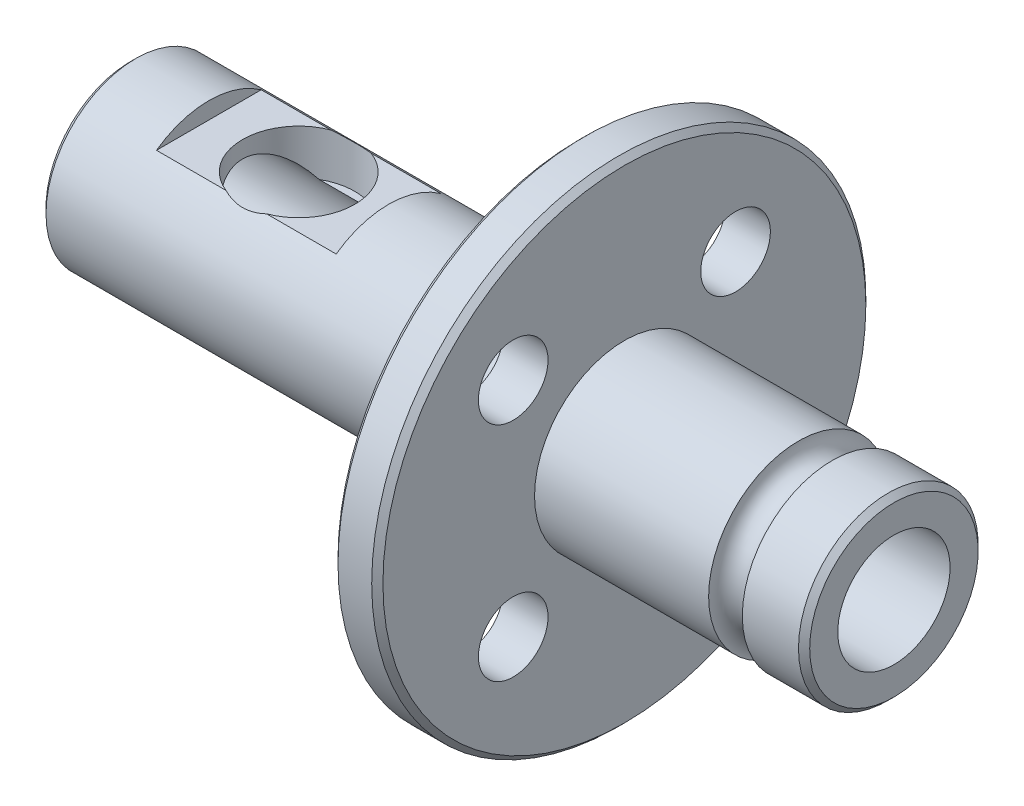
from build123d import *

# Parameters (mm, degrees)
SKETCH2_R               = 2.5
CUT_EXTRUDE1_DEPTH      = 38.389838192
CUT_EXTRUDE2_DEPTH      = 27.944387171
CUT_EXTRUDE2_DEPTH_BACK = 27.944387171
SKETCH3_R               = 1.55
SKETCH4_W               = 8
SKETCH4_H               = 5
CUT_EXTRUDE3_DEPTH      = 0.75
SKETCH5_R               = 2.5
CUT_EXTRUDE4_DEPTH      = 2
CHAMFER1_SIZE           = 0.25


with BuildPart() as part:
    # Sketch1 → Revolve1 (revolve)
    with BuildSketch(Plane.XY, mode=Mode.PRIVATE) as revolve1_sk:
        with BuildLine():
            Line((34, 0), (34, 4))
            Line((34, 4), (31.25, 4))
            ThreePointArc((31.25, 4), (30.5, 3.25), (29.75, 4))
            Line((29.75, 4), (22, 4))
            Line((22, 4), (22, 11))
            Line((22, 11), (20, 11))
            Line((20, 11), (20, 4))
            Line((20, 4), (0, 4))
            Line((0, 4), (0, 0))
            Line((0, 0), (34, 0))
        make_face()
    revolve(revolve1_sk.sketch.rotate(Axis((0, 0, 0), (1, 0, 0)), 90), axis=Axis((0, 0, 0), (1, 0, 0)))

    # Sketch2 → Cut-Extrude1 (cut, through all)
    with BuildSketch(Plane(origin=(34, 0, 0), x_dir=(0, 0, -1), z_dir=(1, 0, 0))):
        Circle(SKETCH2_R)
    extrude(amount=-CUT_EXTRUDE1_DEPTH, mode=Mode.SUBTRACT)

    # Sketch3 → Cut-Extrude2 (cut, two sides: drawn at the far end of the back side and taken through both)
    with BuildSketch(Plane(origin=(22, 0, 0), x_dir=(0, 0, -1), z_dir=(1, 0, 0)).offset(-CUT_EXTRUDE2_DEPTH_BACK)):
        with Locations((4.949747468, 4.949747468)):
            Circle(SKETCH3_R)
        with Locations((4.949747468, -4.949747468)):
            Circle(SKETCH3_R)
        with Locations((-4.949747468, -4.949747468)):
            Circle(SKETCH3_R)
        with Locations((-4.949747468, 4.949747468)):
            Circle(SKETCH3_R)
    extrude(amount=CUT_EXTRUDE2_DEPTH + CUT_EXTRUDE2_DEPTH_BACK, mode=Mode.SUBTRACT)

    # Sketch4 → Cut-Extrude3 (cut)
    with BuildSketch(Plane(origin=(0, 4, 0), x_dir=(1, 0, 0), z_dir=(0, 1, 0))):
        with Locations((7.5, 0)):
            Rectangle(SKETCH4_W, SKETCH4_H)
    extrude(amount=-CUT_EXTRUDE3_DEPTH, mode=Mode.SUBTRACT)

    # Sketch5 → Cut-Extrude4 (cut)
    with BuildSketch(Plane(origin=(0, 3.25, 0), x_dir=(1, 0, 0), z_dir=(0, 1, 0))):
        with Locations(Location((7.5, 0, 0), (0, 0, 248.865707785))):
            Circle(SKETCH5_R)
    extrude(amount=-CUT_EXTRUDE4_DEPTH, mode=Mode.SUBTRACT)

    # Chamfer1
    chamfer1_edges = [part.edges().sort_by_distance(p)[0] for p in [
        (22, 0, -11),
        (20, 0, -11),
        (0, 0, -4),
        (34, 0, -4),
    ]]
    chamfer(chamfer1_edges, length=CHAMFER1_SIZE)


solid = part.part
